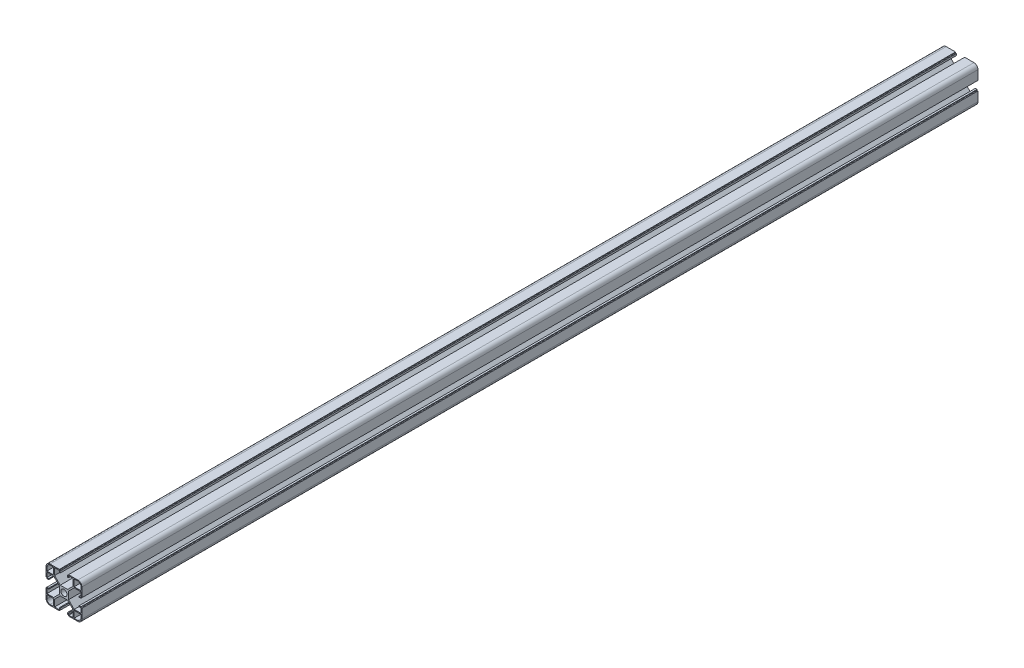
from build123d import *

# Parameters (mm, degrees)
SKETCH_1_R      = 3.4
EXTRUDE_1_DEPTH = 1000


with BuildPart() as part:
    # 草图1 → 凸台-拉伸1 (new body)
    with BuildSketch(Plane.XY):
        with BuildLine():
            Line((-11.148233949, 14.802957359), (-21.548233949, 14.802957359))
            ThreePointArc((-21.548233949, 14.802957359), (-24.730214465, 13.484937874), (-26.048233949, 10.302957359))
            Line((-26.048233949, 10.302957359), (-26.048233949, -0.097042641))
            Line((-26.048233949, -0.097042641), (-25.548233949, -0.097042641))
            ThreePointArc((-25.548233949, -0.097042641), (-25.194680559, -0.24348925), (-25.048233949, -0.597042641))
            Line((-25.048233949, -0.597042641), (-25.048233949, -1.097042641))
            Line((-25.048233949, -1.097042641), (-23.048233949, -1.097042641))
            Line((-23.048233949, -1.097042641), (-23.048233949, -0.097042641))
            Line((-23.048233949, -0.097042641), (-25.048233949, -0.097042641))
            Line((-25.048233949, -0.097042641), (-25.048233949, 5.202957359))
            Line((-25.048233949, 5.202957359), (-17.508894121, 5.202957359))
            Line((-17.508894121, 5.202957359), (-11.248233949, -1.057702813))
            Line((-11.248233949, -1.057702813), (-11.248233949, -9.336382469))
            Line((-11.248233949, -9.336382469), (-17.508894121, -15.597042641))
            Line((-17.508894121, -15.597042641), (-25.048233949, -15.597042641))
            Line((-25.048233949, -15.597042641), (-25.048233949, -10.797042641))
            ThreePointArc((-25.048233949, -10.797042641), (-24.90178734, -10.44348925), (-24.548233949, -10.297042641))
            Line((-24.548233949, -10.297042641), (-23.048233949, -10.297042641))
            Line((-23.048233949, -10.297042641), (-23.048233949, -9.297042641))
            Line((-23.048233949, -9.297042641), (-25.048233949, -9.297042641))
            Line((-25.048233949, -9.297042641), (-25.048233949, -9.797042641))
            ThreePointArc((-25.048233949, -9.797042641), (-25.194680559, -10.150596032), (-25.548233949, -10.297042641))
            Line((-25.548233949, -10.297042641), (-26.048233949, -10.297042641))
            Line((-26.048233949, -10.297042641), (-26.048233949, -20.697042641))
            ThreePointArc((-26.048233949, -20.697042641), (-24.730214465, -23.879023156), (-21.548233949, -25.197042641))
            Line((-21.548233949, -25.197042641), (-11.148233949, -25.197042641))
            Line((-11.148233949, -25.197042641), (-11.148233949, -24.697042641))
            ThreePointArc((-11.148233949, -24.697042641), (-11.00178734, -24.34348925), (-10.648233949, -24.197042641))
            Line((-10.648233949, -24.197042641), (-10.148233949, -24.197042641))
            Line((-10.148233949, -24.197042641), (-10.148233949, -22.197042641))
            Line((-10.148233949, -22.197042641), (-11.148233949, -22.197042641))
            Line((-11.148233949, -22.197042641), (-11.148233949, -23.697042641))
            ThreePointArc((-11.148233949, -23.697042641), (-11.294680559, -24.050596032), (-11.648233949, -24.197042641))
            Line((-11.648233949, -24.197042641), (-16.448233949, -24.197042641))
            Line((-16.448233949, -24.197042641), (-16.448233949, -16.657702813))
            Line((-16.448233949, -16.657702813), (-10.187573777, -10.397042641))
            Line((-10.187573777, -10.397042641), (-1.908894121, -10.397042641))
            Line((-1.908894121, -10.397042641), (4.351766051, -16.657702813))
            Line((4.351766051, -16.657702813), (4.351766051, -24.197042641))
            Line((4.351766051, -24.197042641), (-0.448233949, -24.197042641))
            ThreePointArc((-0.448233949, -24.197042641), (-0.80178734, -24.050596032), (-0.948233949, -23.697042641))
            Line((-0.948233949, -23.697042641), (-0.948233949, -22.197042641))
            Line((-0.948233949, -22.197042641), (-1.948233949, -22.197042641))
            Line((-1.948233949, -22.197042641), (-1.948233949, -24.197042641))
            Line((-1.948233949, -24.197042641), (-1.448233949, -24.197042641))
            ThreePointArc((-1.448233949, -24.197042641), (-1.094680559, -24.34348925), (-0.948233949, -24.697042641))
            Line((-0.948233949, -24.697042641), (-0.948233949, -25.197042641))
            Line((-0.948233949, -25.197042641), (9.451766051, -25.197042641))
            ThreePointArc((9.451766051, -25.197042641), (12.633746566, -23.879023156), (13.951766051, -20.697042641))
            Line((13.951766051, -20.697042641), (13.951766051, -10.297042641))
            Line((13.951766051, -10.297042641), (13.451766051, -10.297042641))
            ThreePointArc((13.451766051, -10.297042641), (13.09821266, -10.150596032), (12.951766051, -9.797042641))
            Line((12.951766051, -9.797042641), (12.951766051, -9.297042641))
            Line((12.951766051, -9.297042641), (10.951766051, -9.297042641))
            Line((10.951766051, -9.297042641), (10.951766051, -10.297042641))
            Line((10.951766051, -10.297042641), (12.451766051, -10.297042641))
            ThreePointArc((12.451766051, -10.297042641), (12.805319441, -10.44348925), (12.951766051, -10.797042641))
            Line((12.951766051, -10.797042641), (12.951766051, -15.597042641))
            Line((12.951766051, -15.597042641), (5.412426223, -15.597042641))
            Line((5.412426223, -15.597042641), (-0.848233949, -9.336382469))
            Line((-0.848233949, -9.336382469), (-0.848233949, -1.057702813))
            Line((-0.848233949, -1.057702813), (5.412426223, 5.202957359))
            Line((5.412426223, 5.202957359), (12.951766051, 5.202957359))
            Line((12.951766051, 5.202957359), (12.951766051, 0.402957359))
            ThreePointArc((12.951766051, 0.402957359), (12.805319441, 0.049403968), (12.451766051, -0.097042641))
            Line((12.451766051, -0.097042641), (10.951766051, -0.097042641))
            Line((10.951766051, -0.097042641), (10.951766051, -1.097042641))
            Line((10.951766051, -1.097042641), (12.951766051, -1.097042641))
            Line((12.951766051, -1.097042641), (12.951766051, -0.597042641))
            ThreePointArc((12.951766051, -0.597042641), (13.09821266, -0.24348925), (13.451766051, -0.097042641))
            Line((13.451766051, -0.097042641), (13.951766051, -0.097042641))
            Line((13.951766051, -0.097042641), (13.951766051, 10.302957359))
            ThreePointArc((13.951766051, 10.302957359), (12.633746566, 13.484937874), (9.451766051, 14.802957359))
            Line((9.451766051, 14.802957359), (-0.948233949, 14.802957359))
            Line((-0.948233949, 14.802957359), (-0.948233949, 14.302957359))
            ThreePointArc((-0.948233949, 14.302957359), (-1.094680559, 13.949403968), (-1.448233949, 13.802957359))
            Line((-1.448233949, 13.802957359), (-1.948233949, 13.802957359))
            Line((-1.948233949, 13.802957359), (-1.948233949, 11.802957359))
            Line((-1.948233949, 11.802957359), (-0.948233949, 11.802957359))
            Line((-0.948233949, 11.802957359), (-0.948233949, 13.302957359))
            ThreePointArc((-0.948233949, 13.302957359), (-0.80178734, 13.65651075), (-0.448233949, 13.802957359))
            Line((-0.448233949, 13.802957359), (4.351766051, 13.802957359))
            Line((4.351766051, 13.802957359), (4.351766051, 6.263617531))
            Line((4.351766051, 6.263617531), (-1.908894121, 0.002957359))
            Line((-1.908894121, 0.002957359), (-10.187573777, 0.002957359))
            Line((-10.187573777, 0.002957359), (-16.448233949, 6.263617531))
            Line((-16.448233949, 6.263617531), (-16.448233949, 13.802957359))
            Line((-16.448233949, 13.802957359), (-11.648233949, 13.802957359))
            ThreePointArc((-11.648233949, 13.802957359), (-11.294680559, 13.65651075), (-11.148233949, 13.302957359))
            Line((-11.148233949, 13.302957359), (-11.148233949, 11.802957359))
            Line((-11.148233949, 11.802957359), (-10.148233949, 11.802957359))
            Line((-10.148233949, 11.802957359), (-10.148233949, 13.802957359))
            Line((-10.148233949, 13.802957359), (-10.648233949, 13.802957359))
            ThreePointArc((-10.648233949, 13.802957359), (-11.00178734, 13.949403968), (-11.148233949, 14.302957359))
            Line((-11.148233949, 14.302957359), (-11.148233949, 14.802957359))
        make_face()
        with Locations((-6.048233949, -5.197042641)):
            Circle(SKETCH_1_R, mode=Mode.SUBTRACT)
        with BuildLine():
            Line((-17.448233949, 13.802957359), (-21.548233949, 13.802957359))
            ThreePointArc((-21.548233949, 13.802957359), (-24.023107683, 12.777831093), (-25.048233949, 10.302957359))
            Line((-25.048233949, 10.302957359), (-25.048233949, 6.202957359))
            Line((-25.048233949, 6.202957359), (-17.448233949, 6.202957359))
            Line((-17.448233949, 6.202957359), (-17.448233949, 13.802957359))
        make_face(mode=Mode.SUBTRACT)
        with BuildLine():
            Line((5.351766051, 13.802957359), (9.451766051, 13.802957359))
            ThreePointArc((9.451766051, 13.802957359), (11.926639785, 12.777831093), (12.951766051, 10.302957359))
            Line((12.951766051, 10.302957359), (12.951766051, 6.202957359))
            Line((12.951766051, 6.202957359), (5.351766051, 6.202957359))
            Line((5.351766051, 6.202957359), (5.351766051, 13.802957359))
        make_face(mode=Mode.SUBTRACT)
        with BuildLine():
            Line((-17.448233949, -24.197042641), (-21.548233949, -24.197042641))
            ThreePointArc((-21.548233949, -24.197042641), (-24.023107683, -23.171916375), (-25.048233949, -20.697042641))
            Line((-25.048233949, -20.697042641), (-25.048233949, -16.597042641))
            Line((-25.048233949, -16.597042641), (-17.448233949, -16.597042641))
            Line((-17.448233949, -16.597042641), (-17.448233949, -24.197042641))
        make_face(mode=Mode.SUBTRACT)
        with BuildLine():
            Line((5.351766051, -24.197042641), (9.451766051, -24.197042641))
            ThreePointArc((9.451766051, -24.197042641), (11.926639785, -23.171916375), (12.951766051, -20.697042641))
            Line((12.951766051, -20.697042641), (12.951766051, -16.597042641))
            Line((12.951766051, -16.597042641), (5.351766051, -16.597042641))
            Line((5.351766051, -16.597042641), (5.351766051, -24.197042641))
        make_face(mode=Mode.SUBTRACT)
    extrude(amount=EXTRUDE_1_DEPTH)


solid = part.part
